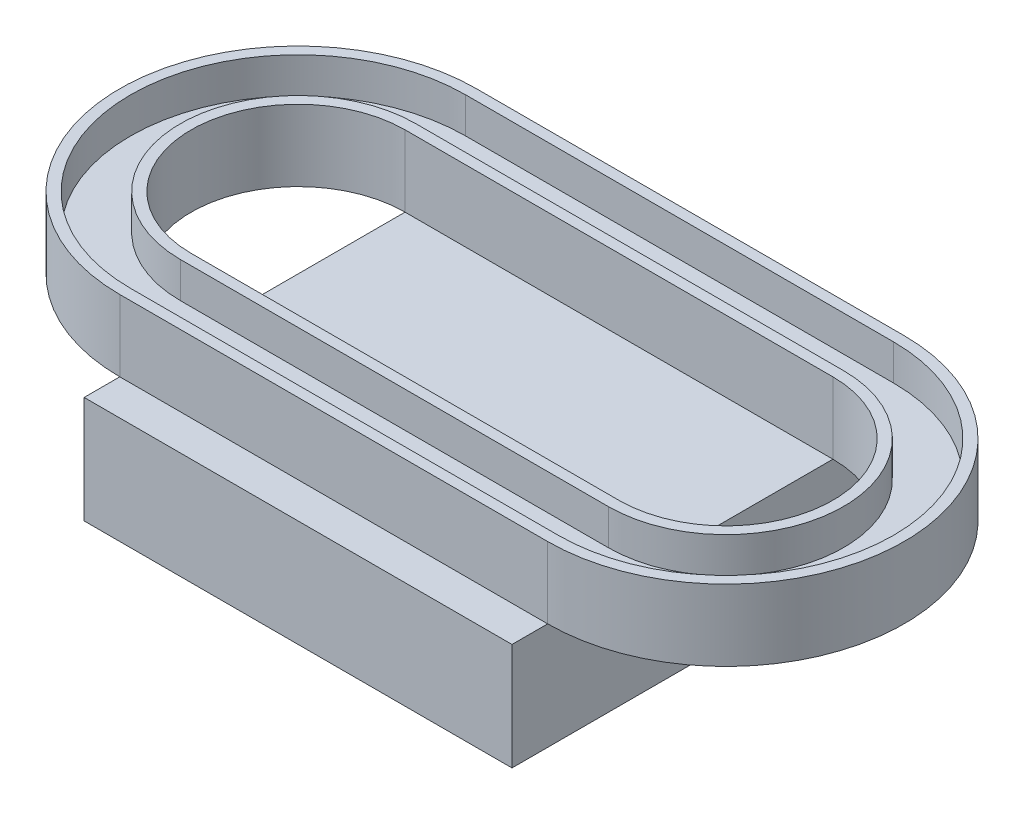
from build123d import *

# Parameters (mm, degrees)
EXTRUDE_3_DEPTH = 10
EXTRUDE_4_DEPTH = 20
SKETCH_6_W      = 120
SKETCH_6_H      = 120
EXTRUDE_5_DEPTH = 30


with BuildPart() as part:
    # 草圖1 → 填料-伸長3 (new body)
    with BuildSketch(Plane(origin=(0, 0, 0), x_dir=(1, 0, 0), z_dir=(0, 1, 0))):
        with BuildLine():
            Line((-60, 50), (60, 50))
            ThreePointArc((60, 50), (110, 0), (60, -50))
            Line((60, -50), (-60, -50))
            ThreePointArc((-60, -50), (-110, 0), (-60, 50))
        make_face()
        with BuildLine():
            Line((-60, -30), (60, -30))
            ThreePointArc((60, -30), (90, 0), (60, 30))
            Line((60, 30), (-60, 30))
            ThreePointArc((-60, 30), (-90, 0), (-60, -30))
        make_face(mode=Mode.SUBTRACT)
    extrude(amount=EXTRUDE_3_DEPTH)

    # 草圖4 → 填料-伸長4 (add)
    # profile 1 of 2: a face of its own
    with BuildSketch(Plane(origin=(0, 0, 0), x_dir=(1, 0, 0), z_dir=(0, 1, 0))):
        with BuildLine():
            Line((-60, 50), (60, 50))
            ThreePointArc((60, 50), (110, 0), (60, -50))
            Line((60, -50), (-60, -50))
            ThreePointArc((-60, -50), (-110, 0), (-60, 50))
        make_face()
        with BuildLine():
            ThreePointArc((60, -47), (107, 0), (60, 47))
            Line((60, 47), (-60, 47))
            ThreePointArc((-60, 47), (-107, 0), (-60, -47))
            Line((-60, -47), (60, -47))
        make_face(mode=Mode.SUBTRACT)
    # profile 2 of 2: a face of its own
    with BuildSketch(Plane(origin=(0, 0, 0), x_dir=(1, 0, 0), z_dir=(0, 1, 0))):
        with BuildLine():
            Line((-60, 33), (60, 33))
            ThreePointArc((60, 33), (93, 0), (60, -33))
            Line((60, -33), (-60, -33))
            ThreePointArc((-60, -33), (-93, 0), (-60, 33))
        make_face()
        with BuildLine():
            ThreePointArc((-60, 30), (-90, 0), (-60, -30))
            Line((-60, -30), (60, -30))
            ThreePointArc((60, -30), (90, 0), (60, 30))
            Line((60, 30), (-60, 30))
        make_face(mode=Mode.SUBTRACT)
    extrude(amount=EXTRUDE_4_DEPTH)

    # 草圖6 → 填料-伸長5 (add)
    with BuildSketch(Plane(origin=(0, 0, 0), x_dir=(1, 0, 0), z_dir=(0, 1, 0))):
        Rectangle(SKETCH_6_W, SKETCH_6_H)
    extrude(amount=-EXTRUDE_5_DEPTH)


solid = part.part
